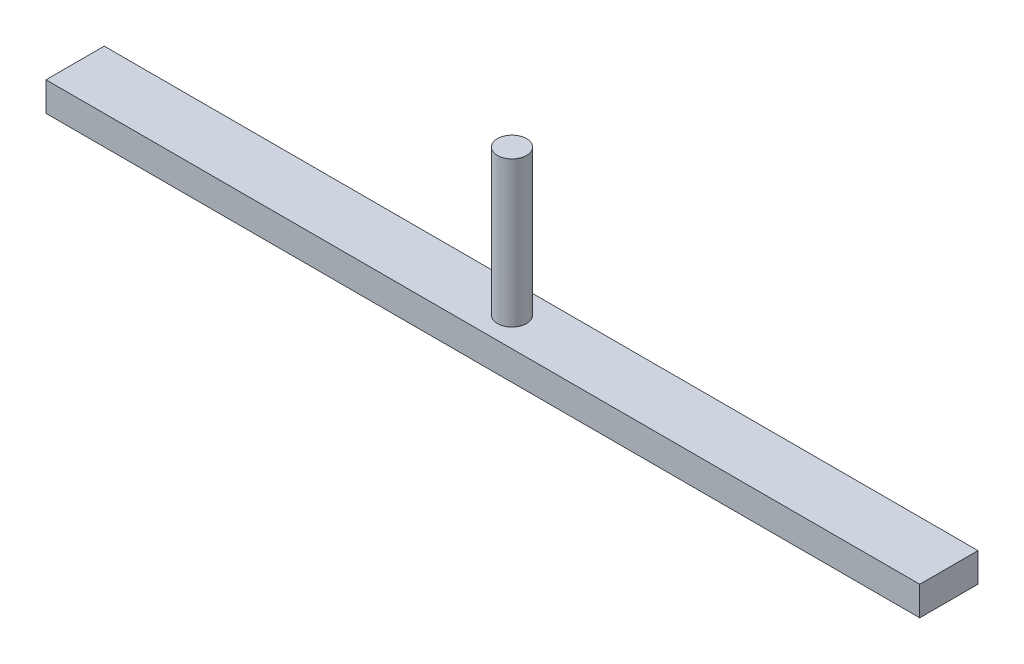
from build123d import *

# Parameters (mm, degrees)
SKETCH1_W           = 150
SKETCH1_H           = 10
BOSS_EXTRUDE2_DEPTH = 5
SKETCH3_R           = 2.5
BOSS_EXTRUDE4_DEPTH = 25


with BuildPart() as part:
    # Sketch1 → Boss-Extrude2 (new body)
    with BuildSketch(Plane(origin=(0, 0, 0), x_dir=(1, 0, 0), z_dir=(0, 1, 0))):
        with Locations((0, 10.539702233)):
            Rectangle(SKETCH1_W, SKETCH1_H)
    extrude(amount=BOSS_EXTRUDE2_DEPTH)

    # Sketch3 → Boss-Extrude4 (add)
    with BuildSketch(Plane(origin=(0, 5, 0), x_dir=(1, 0, 0), z_dir=(0, 1, 0))):
        with Locations(Location((0, 10.539702233, 0), (0, 0, 90))):
            Circle(SKETCH3_R)
    extrude(amount=BOSS_EXTRUDE4_DEPTH)


solid = part.part
